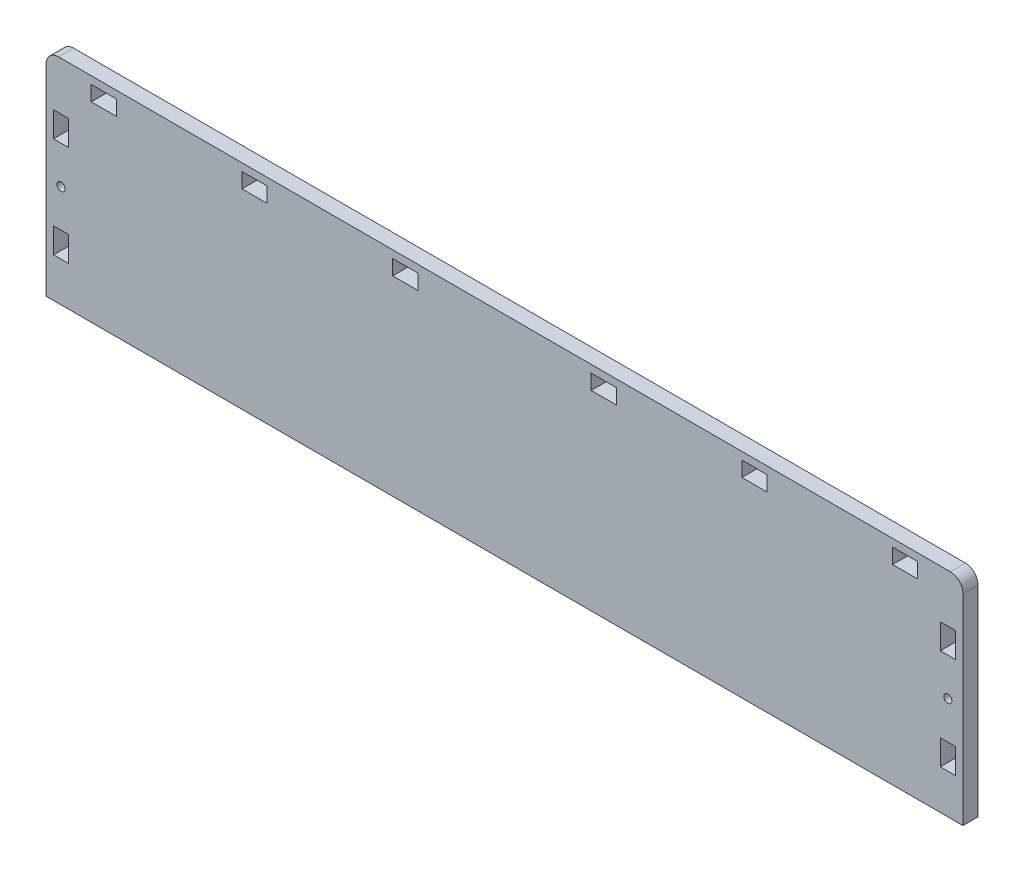
from build123d import *

# Parameters (mm, degrees)
SKETCH_1_R      = 1.6
SKETCH_1_W      = 6
SKETCH_1_H      = 10
SKETCH_1_W_2    = 10
SKETCH_1_H_2    = 6
EXTRUDE_1_DEPTH = 6


with BuildPart() as part:
    # Эскиз1 → Бобышка-Вытянуть1 (new body)
    with BuildSketch(Plane.XY):
        with BuildLine():
            Line((5, 0), (360, 0))
            ThreePointArc((360, 0), (363.535533906, -1.464466094), (365, -5))
            Line((365, -5), (365, -85))
            Line((365, -85), (0, -85))
            Line((0, -85), (0, -5))
            ThreePointArc((0, -5), (1.464466094, -1.464466094), (5, 0))
        make_face()
        with Locations((6, -44.251742496)):
            Circle(SKETCH_1_R, mode=Mode.SUBTRACT)
        with Locations(Location((359, -44.251742496, 0), (0, 0, 180))):
            Circle(SKETCH_1_R, mode=Mode.SUBTRACT)
        with Locations((6, -64.251742496)):
            Rectangle(SKETCH_1_W, SKETCH_1_H, mode=Mode.SUBTRACT)
        with Locations((6, -24.251742496)):
            Rectangle(SKETCH_1_W, SKETCH_1_H, mode=Mode.SUBTRACT)
        with Locations((359, -24.251742496)):
            Rectangle(SKETCH_1_W, SKETCH_1_H, mode=Mode.SUBTRACT)
        with Locations((359, -64.251742496)):
            Rectangle(SKETCH_1_W, SKETCH_1_H, mode=Mode.SUBTRACT)
        with Locations((83, -6)):
            Rectangle(SKETCH_1_W_2, SKETCH_1_H_2, mode=Mode.SUBTRACT)
        with Locations((23, -6)):
            Rectangle(SKETCH_1_W_2, SKETCH_1_H_2, mode=Mode.SUBTRACT)
        with Locations((143, -6)):
            Rectangle(SKETCH_1_W_2, SKETCH_1_H_2, mode=Mode.SUBTRACT)
        with Locations((222, -6)):
            Rectangle(SKETCH_1_W_2, SKETCH_1_H_2, mode=Mode.SUBTRACT)
        with Locations((282, -6)):
            Rectangle(SKETCH_1_W_2, SKETCH_1_H_2, mode=Mode.SUBTRACT)
        with Locations((342, -6)):
            Rectangle(SKETCH_1_W_2, SKETCH_1_H_2, mode=Mode.SUBTRACT)
    extrude(amount=EXTRUDE_1_DEPTH)


solid = part.part
